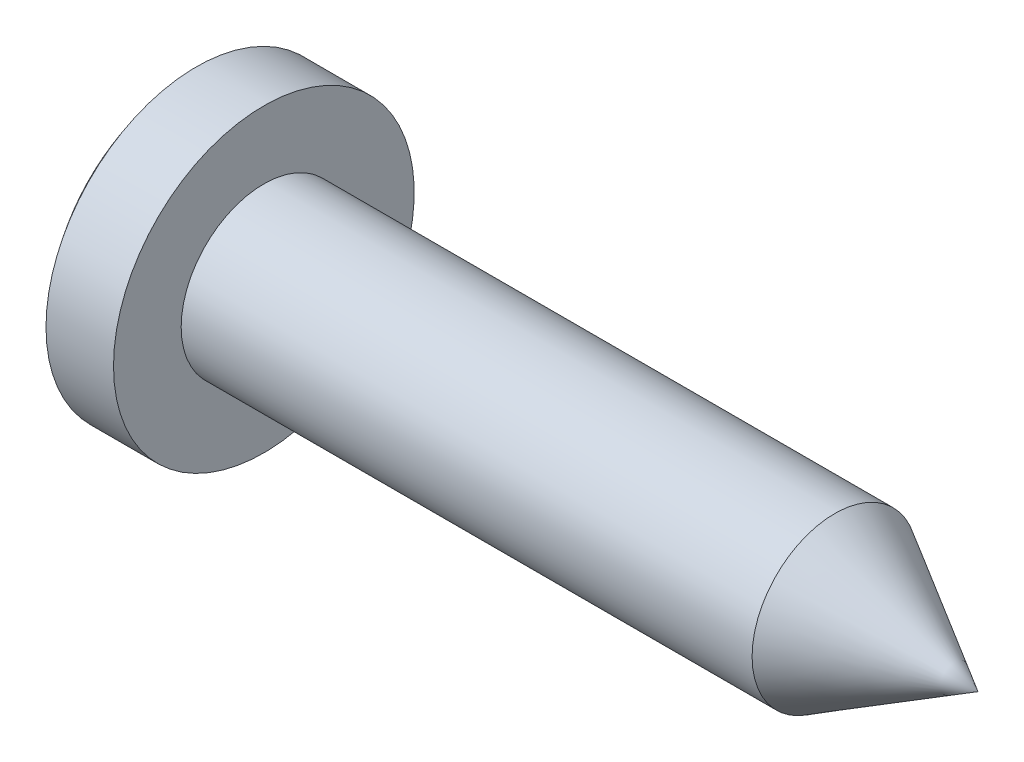
from build123d import *

# Parameters (mm, degrees)
CHAMFER1_SIZE      = 0.22
CHAMFER1_SIZE2     = 0.381051178
CUT_EXTRUDE1_DEPTH = 0.85
CUT_EXTRUDE1_TAPER = 6


with BuildPart() as part:
    # Sketch1 → Revolve1 (revolve)
    with BuildSketch(Plane.XY, mode=Mode.PRIVATE) as revolve1_sk:
        with BuildLine():
            Line((0, 2), (-0.897999199, 2))
            ThreePointArc((-0.897999199, 2), (-1.419403703, 1.059811908), (-1.6, 0))
            Line((-1.6, 0), (9.5, 0))
            Line((9.5, 0), (9.5, 1.1))
            Line((9.5, 1.1), (0, 1.1))
            Line((0, 1.1), (0, 2))
        make_face()
    revolve(revolve1_sk.sketch.rotate(Axis((0, 0, 0), (1, 0, 0)), 90), axis=Axis((0, 0, 0), (1, 0, 0)))

    # Chamfer1
    chamfer1_edges = [part.edges().sort_by_distance(p)[0] for p in [
        (9.5, 0, -1.1),
    ]]
    chamfer1_side = [part.faces().sort_by_distance(p)[0] for p in [
        (9.5, 0, 0),
    ]]
    chamfer(chamfer1_edges, length=CHAMFER1_SIZE, length2=CHAMFER1_SIZE2, reference=chamfer1_side[0])

    # Sketch2 → EndCone (revolve, cut)
    with BuildSketch(Plane.XY, mode=Mode.PRIVATE) as endcone_sk:
        Polygon((9.5, 0), (7.594744112, 1.1), (7.594744112, 1.2), (9.6, 1.2), (9.6, 0), align=None)
    revolve(endcone_sk.sketch.rotate(Axis((0, 0, 0), (1, 0, 0)), 90), axis=Axis((0, 0, 0), (1, 0, 0)), mode=Mode.SUBTRACT)

    # Sketch3 → Cut-Extrude1 (cut)
    with BuildSketch(Plane(origin=(-1.6, 0, 0), x_dir=(0, 0, -1), z_dir=(1, 0, 0))):
        Polygon((-0.2375, 0.95), (-0.1425, 0.57), (-0.29897586, 0.29897586), (-0.57, 0.1425), (-0.95, 0.2375), (-0.95, -0.2375), (-0.57, -0.1425), (-0.29897586, -0.29897586), (-0.1425, -0.57), (-0.2375, -0.95), (0.2375, -0.95), (0.1425, -0.57), (0.29897586, -0.29897586), (0.57, -0.1425), (0.95, -0.2375), (0.95, 0.2375), (0.57, 0.1425), (0.29897586, 0.29897586), (0.1425, 0.57), (0.2375, 0.95), align=None)
    extrude(amount=CUT_EXTRUDE1_DEPTH, taper=CUT_EXTRUDE1_TAPER, mode=Mode.SUBTRACT)


solid = part.part
